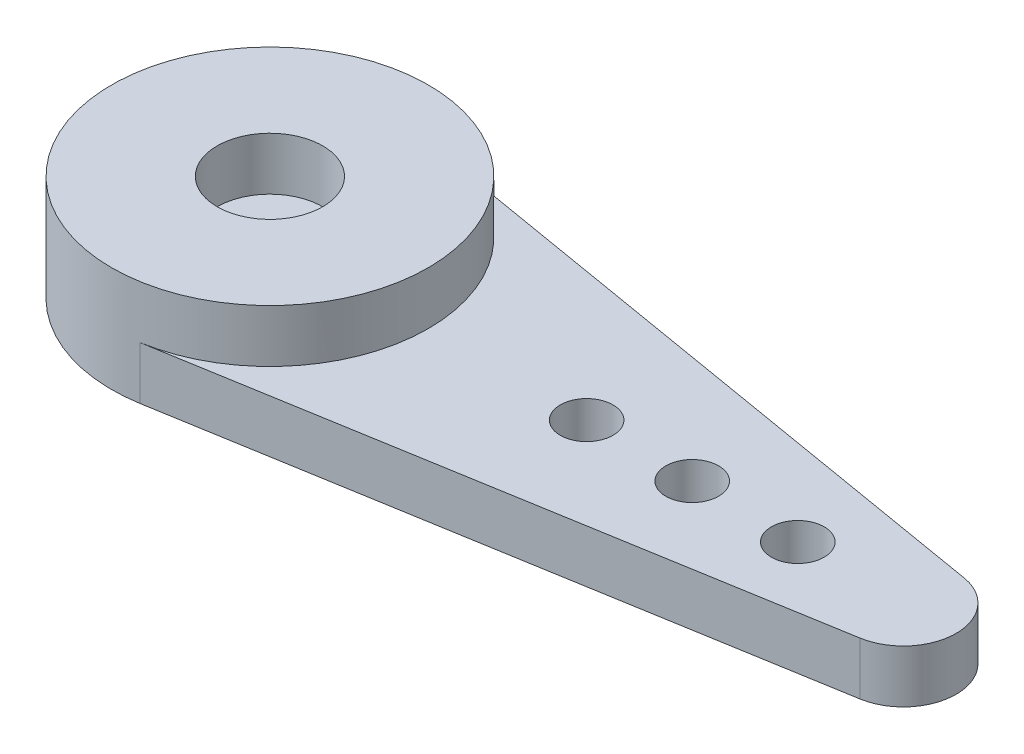
from build123d import *
from build123d.topology import SkipClean

# Parameters (mm, degrees)
BOSS_EXTRUDE1_DEPTH = 5
SKETCH2_R           = 15
BOSS_EXTRUDE2_DEPTH = 5
SKETCH3_R           = 5
CUT_EXTRUDE1_DEPTH  = 5
SKETCH4_R           = 2.5
CUT_EXTRUDE2_DEPTH  = 5


with BuildPart() as part:
    # Sketch1 → Boss-Extrude1 (new body)
    with BuildSketch(Plane(origin=(0, 0, 0), x_dir=(1, 0, 0), z_dir=(0, 1, 0))):
        with BuildLine():
            Line((2.5, 14.790199458), (60.833333333, 4.930066486))
            ThreePointArc((60.833333333, 4.930066486), (65, 0), (60.833333333, -4.930066486))
            Line((60.833333333, -4.930066486), (2.5, -14.790199458))
            ThreePointArc((2.5, -14.790199458), (-15, 0), (2.5, 14.790199458))
        make_face()
    extrude(amount=BOSS_EXTRUDE1_DEPTH)

    # Sketch2 → Boss-Extrude2 (add)
    with SkipClean():  # the faces are left unmerged after this step: merging them gives an invalid solid
        with BuildSketch(Plane(origin=(0, 5, 0), x_dir=(1, 0, 0), z_dir=(0, 1, 0))):
            with Locations(Location((0, 0, 0), (0, 0, 80.405931773))):
                Circle(SKETCH2_R)
        extrude(amount=BOSS_EXTRUDE2_DEPTH)

    # Sketch3 → Cut-Extrude1 (cut)
    with SkipClean():  # the faces are left unmerged after this step: merging them gives an invalid solid
        with BuildSketch(Plane(origin=(0, 10, 0), x_dir=(1, 0, 0), z_dir=(0, 1, 0))):
            with Locations(Location((0, 0, 0), (0, 0, 270))):
                Circle(SKETCH3_R)
        extrude(amount=-CUT_EXTRUDE1_DEPTH, mode=Mode.SUBTRACT)

    # Sketch4 → Cut-Extrude2 (cut)
    with SkipClean():  # the faces are left unmerged after this step: merging them gives an invalid solid
        with BuildSketch(Plane(origin=(0, 5, 0), x_dir=(1, 0, 0), z_dir=(0, 1, 0))):
            with Locations(Location((50, 0, 0), (0, 0, 270))):
                Circle(SKETCH4_R)
            with Locations(Location((40, 0, 0), (0, 0, 270))):
                Circle(SKETCH4_R)
            with Locations(Location((30, 0, 0), (0, 0, 270))):
                Circle(SKETCH4_R)
        extrude(amount=-CUT_EXTRUDE2_DEPTH, mode=Mode.SUBTRACT)


solid = part.part
